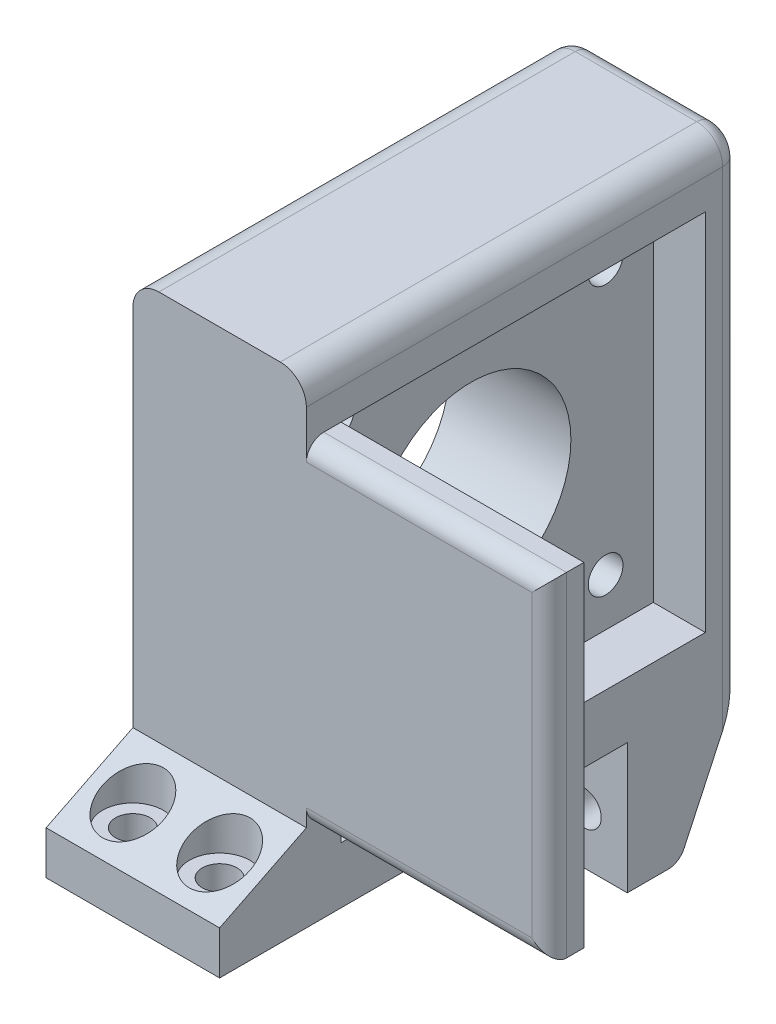
from build123d import *

# Parameters (mm, degrees)
SKETCH1_W           = 20
SKETCH1_H           = 50
BOSS_EXTRUDE1_DEPTH = 70
SKETCH2_R           = 2
SKETCH2_R_2         = 11.5
CUT_EXTRUDE2_DEPTH  = 60
SKETCH4_W           = 37
SKETCH4_H           = 15
CUT_EXTRUDE3_DEPTH  = 60
SKETCH8_R           = 2
CUT_EXTRUDE5_DEPTH  = 15
SKETCH9_W           = 42
SKETCH9_H           = 42
CUT_EXTRUDE6_DEPTH  = 6
CUT_EXTRUDE8_DEPTH  = 30
SKETCH12_W          = 20
SKETCH12_H          = 5
BOSS_EXTRUDE2_DEPTH = 10
BOSS_EXTRUDE3_DEPTH = 20
SKETCH15_R          = 2
CUT_EXTRUDE9_DEPTH  = 10
SKETCH17_R          = 3.5
CUT_EXTRUDE11_DEPTH = 8
SKETCH18_R          = 3.5
CUT_EXTRUDE12_DEPTH = 50
FILLET2_R           = 3
FILLET3_R           = 3
FILLET5_R           = 2
FILLET6_R           = 2
SKETCH19_W          = 4
SKETCH19_H          = 38.5
BOSS_EXTRUDE4_DEPTH = 28
FILLET7_R           = 2


with BuildPart() as part:
    # Sketch1 → Boss-Extrude1 (new body)
    with BuildSketch(Plane(origin=(0, 0, 0), x_dir=(1, 0, 0), z_dir=(0, 1, 0))):
        with Locations((-10, -25)):
            Rectangle(SKETCH1_W, SKETCH1_H)
    extrude(amount=BOSS_EXTRUDE1_DEPTH)

    # Sketch2 → Cut-Extrude2 (cut)
    with BuildSketch(Plane(origin=(0, 0, 0), x_dir=(0, 0, -1), z_dir=(1, 0, 0))):
        with Locations((-9.5, 58)):
            Circle(SKETCH2_R)
        with Locations((-25, 42.5)):
            Circle(SKETCH2_R_2)
        with Locations((-9.5, 27)):
            Circle(SKETCH2_R)
        with Locations((-40.5, 27)):
            Circle(SKETCH2_R)
        with Locations((-40.5, 58)):
            Circle(SKETCH2_R)
    extrude(amount=-CUT_EXTRUDE2_DEPTH, mode=Mode.SUBTRACT)

    # Sketch4 → Cut-Extrude3 (cut)
    with BuildSketch(Plane(origin=(0, 0, 0), x_dir=(0, 0, -1), z_dir=(1, 0, 0))):
        with Locations((-31.5, 7.5)):
            Rectangle(SKETCH4_W, SKETCH4_H)
    extrude(amount=-CUT_EXTRUDE3_DEPTH, mode=Mode.SUBTRACT)

    # Sketch8 → Cut-Extrude5 (cut)
    with BuildSketch(Plane(origin=(0, 0, 0), x_dir=(-1, 0, 0), z_dir=(0, 0, -1))):
        with Locations((15, 6)):
            Circle(SKETCH8_R)
        with Locations((5, 6)):
            Circle(SKETCH8_R)
    extrude(amount=-CUT_EXTRUDE5_DEPTH, mode=Mode.SUBTRACT)

    # Sketch9 → Cut-Extrude6 (cut)
    with BuildSketch(Plane(origin=(0, 0, 0), x_dir=(0, 0, -1), z_dir=(1, 0, 0))):
        with Locations((-25, 42.5)):
            Rectangle(SKETCH9_W, SKETCH9_H)
    extrude(amount=-CUT_EXTRUDE6_DEPTH, mode=Mode.SUBTRACT)

    # Sketch11 → Cut-Extrude8 (cut)
    with BuildSketch(Plane(origin=(0, 0, 0), x_dir=(0, 0, -1), z_dir=(1, 0, 0))):
        Polygon((-7, 0), (0, 0), (0, 15), align=None)
    extrude(amount=-CUT_EXTRUDE8_DEPTH, mode=Mode.SUBTRACT)

    # Sketch12 → Boss-Extrude2 (add)
    with BuildSketch(Plane.XY.offset(50)):
        with Locations((-10, 17.5)):
            Rectangle(SKETCH12_W, SKETCH12_H)
    extrude(amount=BOSS_EXTRUDE2_DEPTH)

    # Sketch14 → Boss-Extrude3 (add)
    with BuildSketch(Plane(origin=(0, 0, 0), x_dir=(0, 0, -1), z_dir=(1, 0, 0))):
        Polygon((-50, 20), (-60, 20), (-50, 25), align=None)
    extrude(amount=-BOSS_EXTRUDE3_DEPTH)

    # Sketch15 → Cut-Extrude9 (cut)
    with BuildSketch(Plane(origin=(0, 15, 0), x_dir=(-1, 0, 0), z_dir=(0, -1, 0))):
        with Locations(Location((5, -55, 0), (0, 0, 90))):
            Circle(SKETCH15_R)
        with Locations(Location((15, -55, 0), (0, 0, 90))):
            Circle(SKETCH15_R)
    extrude(amount=-CUT_EXTRUDE9_DEPTH, mode=Mode.SUBTRACT)

    # Sketch17 → Cut-Extrude11 (cut)
    with BuildSketch(Plane(origin=(0, 0, 0), x_dir=(-1, 0, 0), z_dir=(0, 0, -1))):
        with Locations((15, 6)):
            Circle(SKETCH17_R)
        with Locations((5, 6)):
            Circle(SKETCH17_R)
    extrude(amount=-CUT_EXTRUDE11_DEPTH, mode=Mode.SUBTRACT)

    # Sketch18 → Cut-Extrude12 (cut)
    with BuildSketch(Plane(origin=(0, 70, 0), x_dir=(1, 0, 0), z_dir=(0, 1, 0))):
        with Locations(Location((-15, -55, 0), (0, 0, 270))):
            Circle(SKETCH18_R)
        with Locations(Location((-5, -55, 0), (0, 0, 270))):
            Circle(SKETCH18_R)
    extrude(amount=-CUT_EXTRUDE12_DEPTH, mode=Mode.SUBTRACT)

    # Fillet2
    fillet2_edges = [part.edges().sort_by_distance(p)[0] for p in [
        (0, 70, 25),
    ]]
    fillet(fillet2_edges, radius=FILLET2_R)

    # Fillet3
    fillet3_edges = [part.edges().sort_by_distance(p)[0] for p in [
        (-20, 70, 25),
    ]]
    fillet(fillet3_edges, radius=FILLET3_R)

    # Fillet5
    fillet5_edges = [part.edges().sort_by_distance(p)[0] for p in [
        (-10, 70, 0),
        (0, 41, 0),
        (-0.878679656, 69.121320344, 0),
        (-20, 41, 0),
        (-19.121320344, 69.121320344, 0),
    ]]
    fillet(fillet5_edges, radius=FILLET5_R)

    # Fillet6
    fillet6_edges = [part.edges().sort_by_distance(p)[0] for p in [
        (-10, 0, 7),
    ]]
    fillet(fillet6_edges, radius=FILLET6_R)

    # Sketch19 → Boss-Extrude4 (add)
    with BuildSketch(Plane(origin=(0, 0, 0), x_dir=(0, 0, -1), z_dir=(1, 0, 0))):
        with Locations((-48, 44.25)):
            Rectangle(SKETCH19_W, SKETCH19_H)
    extrude(amount=BOSS_EXTRUDE4_DEPTH)

    # Fillet7
    fillet7_edges = [part.edges().sort_by_distance(p)[0] for p in [
        (14, 63.5, 50),
        (14, 25, 50),
        (28, 44.25, 50),
    ]]
    fillet(fillet7_edges, radius=FILLET7_R)


solid = part.part
